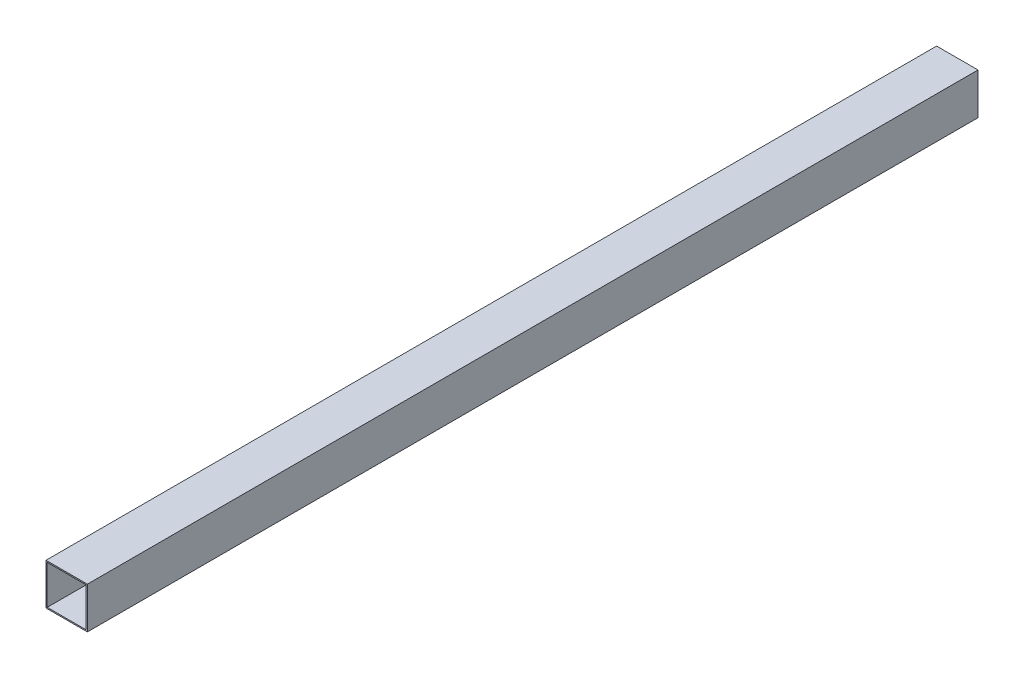
from build123d import *

# Parameters (mm, degrees)
SKETCH1_W           = 85
SKETCH1_H           = 85
SKETCH1_W_2         = 80
SKETCH1_H_2         = 80
BOSS_EXTRUDE1_DEPTH = 1828.8


with BuildPart() as part:
    # Sketch1 → Boss-Extrude1 (new body)
    with BuildSketch(Plane.XY):
        Rectangle(SKETCH1_W, SKETCH1_H)
        Rectangle(SKETCH1_W_2, SKETCH1_H_2, mode=Mode.SUBTRACT)
    extrude(amount=BOSS_EXTRUDE1_DEPTH)


solid = part.part
